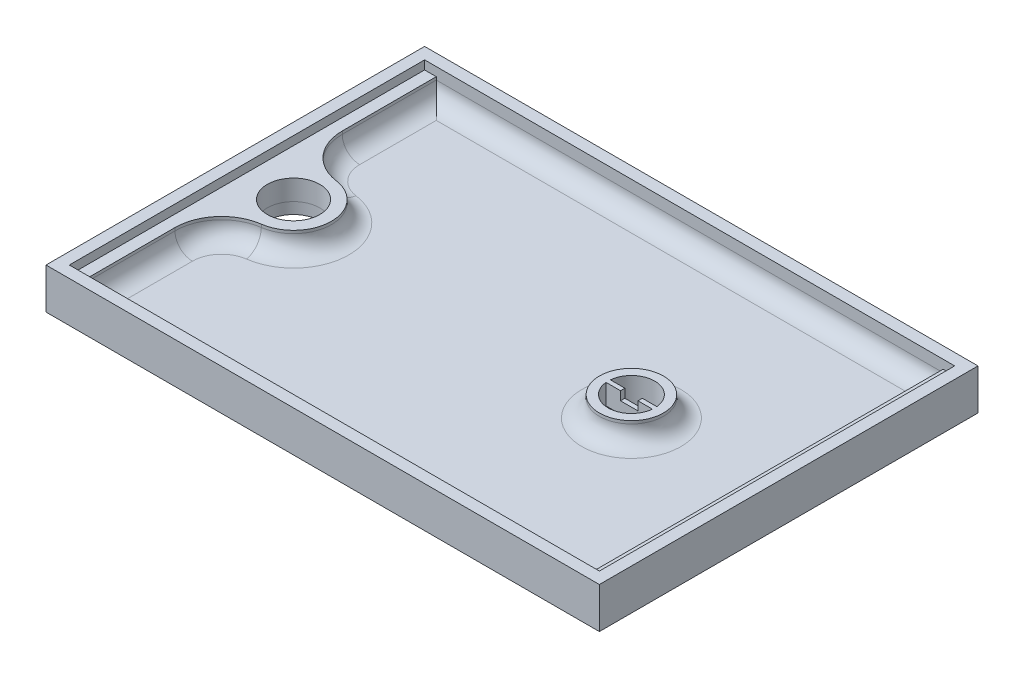
from build123d import *

# Parameters (mm, degrees)
PCB_STAND_DEPTH     = 30.5
SKETCH3_W           = 95
SKETCH3_H           = 7
EXTRA_BOTTOM_DEPTH  = 2
SENSOR_HOLES_2_R    = 4.6
SENSOR_HOLES_2_R_2  = 4
SENSOR_HOLES_DEPTH  = 58.97844427
SKETCH4_R           = 5.5
SKETCH4_R_2         = 4.5
SENSOR_STANDS_DEPTH = 3.5
FILLET1_R           = 3
SKETCH5_W           = 3
SKETCH5_H           = 0.75
TOF_SLOT_DEPTH      = 1.5


with BuildPart() as part:
    # Master_Geometry → PCB_Stand (new, symmetric)
    with BuildSketch(Plane.XY):
        Polygon((-47.5, -5), (-47.5, 0), (-45.5, 0), (-45.5, -1.5), (-43.5, -1.5), (-43.5, -5), (43.5, -5), (43.5, -1.5), (45.5, -1.5), (45.5, 0), (47.5, 0), (47.5, -5), (47.5, -7), (-47.5, -7), align=None)
    extrude(amount=PCB_STAND_DEPTH, both=True)

    # Sketch3 → Extra_Bottom (add)
    with BuildSketch(Plane.XY.offset(30.5)):
        with Locations((0, -3.5)):
            Rectangle(SKETCH3_W, SKETCH3_H)
    extra_bottom = extrude(amount=EXTRA_BOTTOM_DEPTH)

    # Mirror2: Extra_Bottom across plane
    add(extra_bottom.mirror(Plane.XY))

    # Sensor-Holes 2 → Sensor_Holes (cut, through all)
    with BuildSketch(Plane.XZ.offset(7)):
        with Locations((-37.5, 0)):
            Circle(SENSOR_HOLES_2_R)
        with Locations((20.5, 0)):
            Circle(SENSOR_HOLES_2_R_2)
    extrude(amount=-SENSOR_HOLES_DEPTH, mode=Mode.SUBTRACT)

    # Sketch4 → Sensor_Stands (add)
    # profile 1 of 2: a face of its own
    with BuildSketch(Plane(origin=(0, -5, 0), x_dir=(1, 0, 0), z_dir=(0, 1, 0))):
        with Locations(Location((20.5, 0, 0), (0, 0, 90))):
            Circle(SKETCH4_R)
        with BuildLine():
            Line((16.517616919, 0.375), (24.482383081, 0.375))
            ThreePointArc((24.482383081, 0.375), (20.5, 4), (16.517616919, 0.375))
        make_face(mode=Mode.SUBTRACT)
        with BuildLine():
            Line((16.517616919, -0.375), (24.482383081, -0.375))
            ThreePointArc((24.482383081, -0.375), (20.5, -4), (16.517616919, -0.375))
        make_face(mode=Mode.SUBTRACT)
    # profile 2 of 2: a face of its own
    with BuildSketch(Plane(origin=(0, -5, 0), x_dir=(1, 0, 0), z_dir=(0, 1, 0))):
        with BuildLine():
            Line((-43.5, 14.361406616), (-43.5, -14.361406616))
            ThreePointArc((-43.5, -14.361406616), (-41.534384236, -9.109149302), (-36.603448276, -6.437871931))
            ThreePointArc((-36.603448276, -6.437871931), (-31, 0), (-36.603448276, 6.437871931))
            ThreePointArc((-36.603448276, 6.437871931), (-41.534384236, 9.109149302), (-43.5, 14.361406616))
        make_face()
        with Locations(Location((-37.5, 0, 0), (0, 0, 90))):
            Circle(SKETCH4_R_2, mode=Mode.SUBTRACT)
    extrude(amount=SENSOR_STANDS_DEPTH)

    # Fillet1
    fillet1_edges = [part.edges().sort_by_distance(p)[0] for p in [
        (-41.534384236, -5, 9.109149302),
        (-31, -5, 0),
        (-41.534384236, -5, -9.109149302),
        (0, -5, -30.5),
        (-43.5, -5, 22.430703308),
        (43.5, -5, 0),
        (0, -5, 30.5),
        (20.5, -5, 5.5),
        (-43.5, -5, -22.430703308),
    ]]
    fillet(fillet1_edges, radius=FILLET1_R)

    # Sketch5 → ToF_Slot (cut)
    with BuildSketch(Plane(origin=(0, -1.5, 0), x_dir=(1, 0, 0), z_dir=(0, 1, 0))):
        with Locations((20.5, 0)):
            Rectangle(SKETCH5_W, SKETCH5_H)
    extrude(amount=-TOF_SLOT_DEPTH, mode=Mode.SUBTRACT)


solid = part.part
